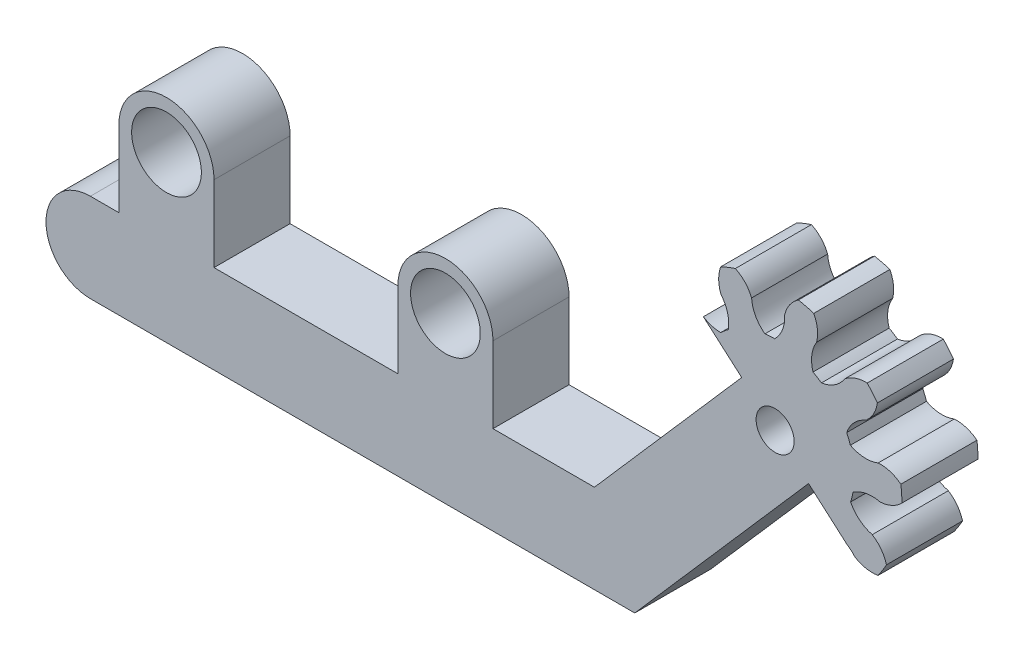
from build123d import *

# Parameters (mm, degrees)
CROQUIS2_R              = 2.75
SALIENTE_EXTRUIR1_DEPTH = 6
SALIENTE_EXTRUIR2_START = -6
SALIENTE_EXTRUIR2_DEPTH = 6
CORTAR_EXTRUIR1_DEPTH   = 71.114192572
CROQUIS5_R              = 1.5
CORTAR_EXTRUIR2_DEPTH   = 71.046461519


with BuildPart() as part:
    # Croquis2 → Saliente-Extruir1 (new body)
    with BuildSketch(Plane.XY):
        with BuildLine():
            Line((0, 0), (42.930999161, 0))
            Line((42.930999161, 0), (56.636539912, 15.69811875))
            ThreePointArc((56.636539912, 15.69811875), (56.30188125, 20.636539912), (51.363460088, 20.30188125))
            Line((51.363460088, 20.30188125), (39.75, 7))
            Line((39.75, 7), (31.75, 7))
            Line((31.75, 7), (31.75, 13))
            ThreePointArc((31.75, 13), (28, 16.75), (24.25, 13))
            Line((24.25, 13), (24.25, 7))
            Line((24.25, 7), (9.75, 7))
            Line((9.75, 7), (9.75, 13))
            ThreePointArc((9.75, 13), (6, 16.75), (2.25, 13))
            Line((2.25, 13), (2.25, 7))
            Line((2.25, 7), (0, 7))
            ThreePointArc((0, 7), (-3.5, 3.5), (0, 0))
        make_face()
        with Locations(Location((6, 13, 0), (0, 0, 180))):
            Circle(CROQUIS2_R, mode=Mode.SUBTRACT)
        with Locations(Location((28, 13, 0), (0, 0, 180))):
            Circle(CROQUIS2_R, mode=Mode.SUBTRACT)
    extrude(amount=SALIENTE_EXTRUIR1_DEPTH)

    # Croquis3 → Saliente-Extruir2 (add)
    with BuildSketch(Plane.XY.offset(6).offset(SALIENTE_EXTRUIR2_START)):
        with BuildLine():
            Line((51.363460088, 20.30188125), (46.467028822, 24.576803572))
            ThreePointArc((46.467028822, 24.576803572), (60.576803572, 25.532971178), (61.532971178, 11.423196428))
            Line((61.532971178, 11.423196428), (56.636539912, 15.69811875))
            ThreePointArc((56.636539912, 15.69811875), (56.30188125, 20.636539912), (51.363460088, 20.30188125))
        make_face()
    extrude(amount=SALIENTE_EXTRUIR2_DEPTH)

    # Croquis4 → Cortar-Extruir1 (cut, through all)
    with BuildSketch(Plane.XY.offset(6)):
        with BuildLine():
            ThreePointArc((49.70655821, 27.031409502), (47.593627222, 25.678436548), (45.883978244, 23.842105002))
            ThreePointArc((45.883978244, 23.842105002), (46.836617605, 23.831529671), (47.722398468, 23.480779257))
            ThreePointArc((47.722398468, 23.480779257), (48.610097364, 22.792823599), (49.70436623, 22.540102483))
            ThreePointArc((49.70436623, 22.540102483), (49.995888886, 22.799176411), (50.303002079, 23.03956411))
            ThreePointArc((50.303002079, 23.03956411), (50.250428059, 24.161405581), (49.732651549, 25.157999682))
            ThreePointArc((49.732651549, 25.157999682), (49.54628016, 26.09229048), (49.70655821, 27.031409502))
        make_face()
        with BuildLine():
            ThreePointArc((55.83506194, 27.830185536), (53.330407314, 27.977557098), (50.867903635, 27.496840125))
            ThreePointArc((50.867903635, 27.496840125), (51.632389044, 26.928337135), (52.142834895, 26.123925161))
            ThreePointArc((52.142834895, 26.123925161), (52.456628197, 25.045581024), (53.193364562, 24.197930244))
            ThreePointArc((53.193364562, 24.197930244), (53.581491179, 24.236172737), (53.971247316, 24.250133864))
            ThreePointArc((53.971247316, 24.250133864), (54.588115912, 25.188624914), (54.755009231, 26.299227874))
            ThreePointArc((54.755009231, 26.299227874), (55.153393963, 27.164631362), (55.83506194, 27.830185536))
        make_face()
        with BuildLine():
            ThreePointArc((61.262634381, 24.874164811), (59.322949053, 26.46558996), (57.048183382, 27.524105106))
            ThreePointArc((57.048183382, 27.524105106), (57.332507396, 26.614823277), (57.272645269, 25.664007776))
            ThreePointArc((57.272645269, 25.664007776), (56.892674603, 24.607165968), (56.990470215, 23.488359312))
            ThreePointArc((56.990470215, 23.488359312), (57.326949617, 23.291163037), (57.6504751, 23.073364917))
            ThreePointArc((57.6504751, 23.073364917), (58.701163476, 23.470033862), (59.488979049, 24.270433099))
            ThreePointArc((59.488979049, 24.270433099), (60.319950474, 24.736394558), (61.262634381, 24.874164811))
        make_face()
        with BuildLine():
            ThreePointArc((63.916127336, 19.292446773), (63.282305175, 21.720055193), (62.064160681, 23.913485649))
            ThreePointArc((62.064160681, 23.913485649), (61.75972119, 23.010739734), (61.152416384, 22.276699911))
            ThreePointArc((61.152416384, 22.276699911), (60.223817628, 21.645038081), (59.645317888, 20.682421665))
            ThreePointArc((59.645317888, 20.682421665), (59.80162638, 20.325108897), (59.935345471, 19.958743009))
            ThreePointArc((59.935345471, 19.958743009), (61.018526379, 19.662075794), (62.126345433, 19.846546004))
            ThreePointArc((62.126345433, 19.846546004), (63.072500712, 19.735083994), (63.916127336, 19.292446773))
        make_face()
        with BuildLine():
            ThreePointArc((62.781996685, 13.217057996), (63.696136214, 15.553585782), (63.99990269, 18.044115666))
            ThreePointArc((63.99990269, 18.044115666), (63.222985233, 17.492723921), (62.300207541, 17.255838039))
            ThreePointArc((62.300207541, 17.255838039), (61.177673859, 17.290629538), (60.143846005, 16.851890114))
            ThreePointArc((60.143846005, 16.851890114), (60.060279056, 16.470942186), (59.953115608, 16.095947847))
            ThreePointArc((59.953115608, 16.095947847), (60.655050756, 15.219261265), (61.659724067, 14.717341097))
            ThreePointArc((61.659724067, 14.717341097), (62.359664041, 14.071030318), (62.781996685, 13.217057996))
        make_face()
        with BuildLine():
            ThreePointArc((58.29344179, 8.968590498), (60.406372778, 10.321563452), (62.116021756, 12.157894998))
            ThreePointArc((62.116021756, 12.157894998), (61.163382395, 12.168470329), (60.277601532, 12.519220743))
            ThreePointArc((60.277601532, 12.519220743), (59.389902636, 13.207176401), (58.29563377, 13.459897517))
            ThreePointArc((58.29563377, 13.459897517), (58.004111114, 13.200823589), (57.696997921, 12.96043589))
            ThreePointArc((57.696997921, 12.96043589), (57.749571941, 11.838594419), (58.267348451, 10.842000318))
            ThreePointArc((58.267348451, 10.842000318), (58.45371984, 9.90770952), (58.29344179, 8.968590498))
        make_face()
    extrude(amount=-CORTAR_EXTRUIR1_DEPTH, mode=Mode.SUBTRACT)

    # Croquis5 → Cortar-Extruir2 (cut, through all)
    with BuildSketch(Plane.XY.offset(6)):
        with Locations((54, 18)):
            Circle(CROQUIS5_R)
    extrude(amount=-CORTAR_EXTRUIR2_DEPTH, mode=Mode.SUBTRACT)


solid = part.part
